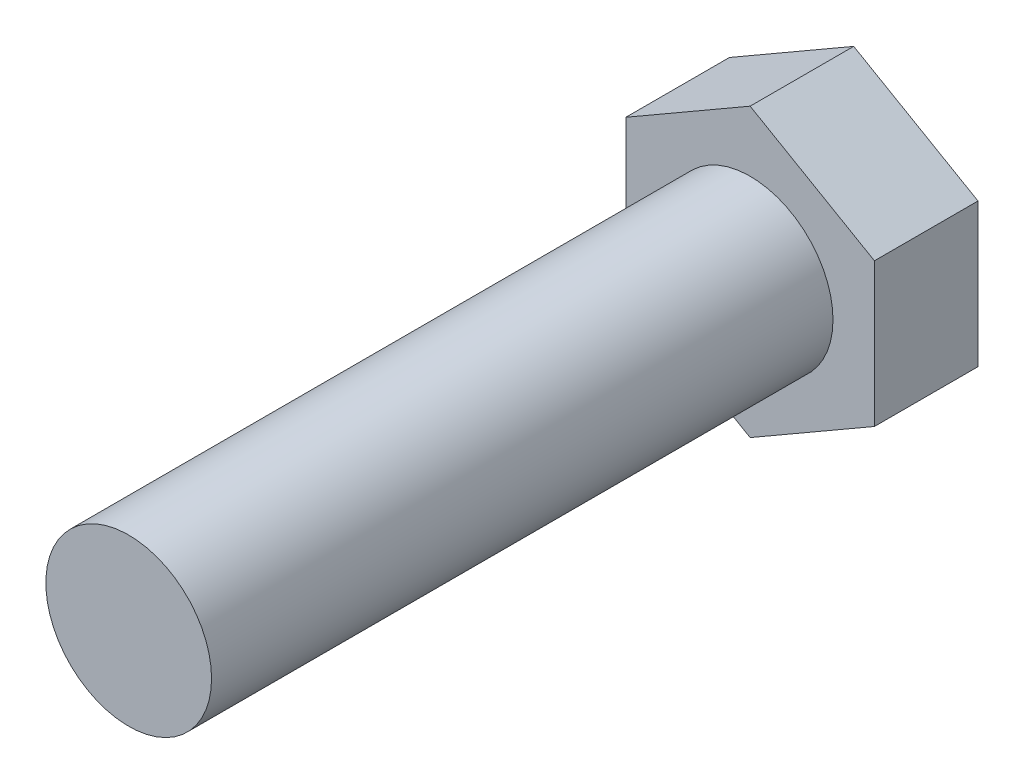
from build123d import *

# Parameters (mm, degrees)
BOSS_EXTRUDE1_DEPTH = 5
SKETCH2_R           = 4
BOSS_EXTRUDE2_DEPTH = 30


with BuildPart() as part:
    # Sketch1 → Boss-Extrude1 (new body)
    with BuildSketch(Plane.XY):
        Polygon((0, 6.92820323), (-6, 3.464101615), (-6, -3.464101615), (0, -6.92820323), (6, -3.464101615), (6, 3.464101615), align=None)
    extrude(amount=BOSS_EXTRUDE1_DEPTH)

    # Sketch2 → Boss-Extrude2 (add)
    with BuildSketch(Plane.XY.offset(5)):
        Circle(SKETCH2_R)
    extrude(amount=BOSS_EXTRUDE2_DEPTH)


solid = part.part
